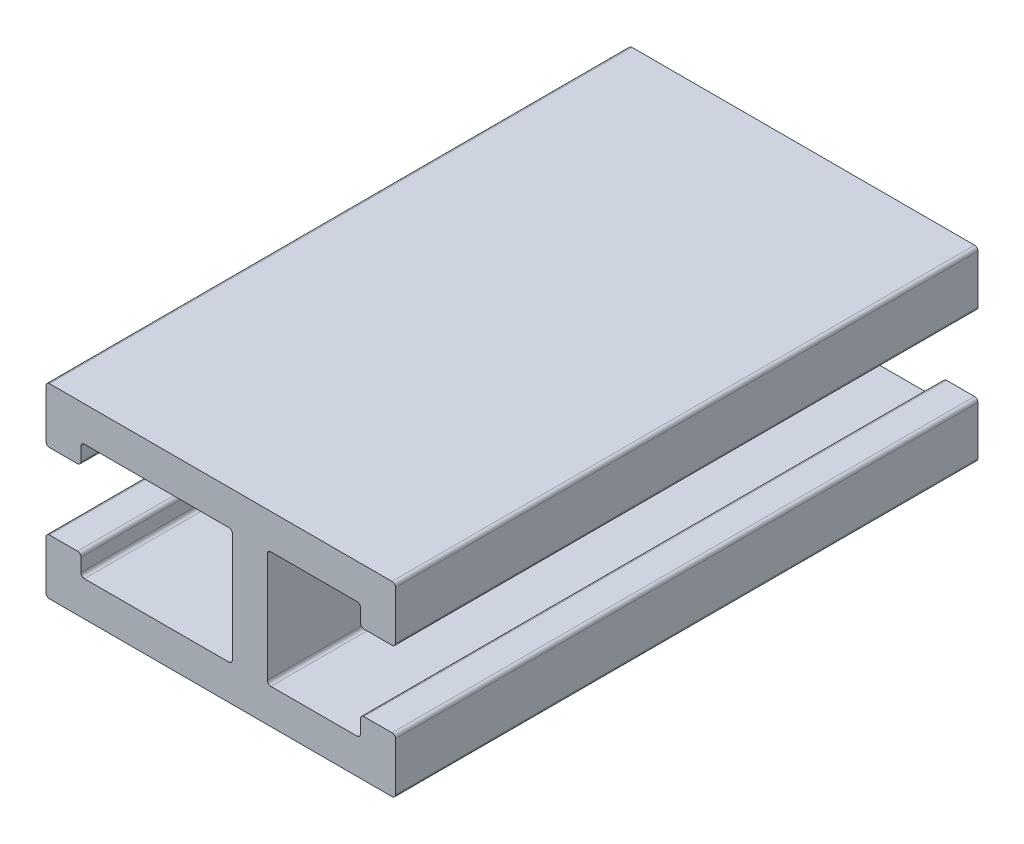
from build123d import *

# Parameters (mm, degrees)
EXTRUDE_1_DEPTH = 50


with BuildPart() as part:
    # 草图1 → 凸台-拉伸1 (new body)
    with BuildSketch(Plane.XY):
        with BuildLine():
            Line((-11.577197952, 5.757012623), (0.822802048, 5.757012623))
            ThreePointArc((0.822802048, 5.757012623), (1.034934082, 5.669144657), (1.122802048, 5.457012623))
            Line((1.122802048, 5.457012623), (1.122802048, -3.942987377))
            ThreePointArc((1.122802048, -3.942987377), (1.034934082, -4.155119412), (0.822802048, -4.242987377))
            Line((0.822802048, -4.242987377), (-11.577197952, -4.242987377))
            ThreePointArc((-11.577197952, -4.242987377), (-11.789329987, -4.155119412), (-11.877197952, -3.942987377))
            Line((-11.877197952, -3.942987377), (-11.877197952, -2.792987377))
            ThreePointArc((-11.877197952, -2.792987377), (-11.965065918, -2.580855343), (-12.177197952, -2.492987377))
            Line((-12.177197952, -2.492987377), (-14.577197952, -2.492987377))
            ThreePointArc((-14.577197952, -2.492987377), (-14.789329987, -2.580855343), (-14.877197952, -2.792987377))
            Line((-14.877197952, -2.792987377), (-14.877197952, -6.942987377))
            ThreePointArc((-14.877197952, -6.942987377), (-14.789329987, -7.155119412), (-14.577197952, -7.242987377))
            Line((-14.577197952, -7.242987377), (14.822802048, -7.242987377))
            ThreePointArc((14.822802048, -7.242987377), (15.034934082, -7.155119412), (15.122802048, -6.942987377))
            Line((15.122802048, -6.942987377), (15.122802048, -2.792987377))
            ThreePointArc((15.122802048, -2.792987377), (15.034934082, -2.580855343), (14.822802048, -2.492987377))
            Line((14.822802048, -2.492987377), (12.422802048, -2.492987377))
            ThreePointArc((12.422802048, -2.492987377), (12.210670013, -2.580855343), (12.122802048, -2.792987377))
            Line((12.122802048, -2.792987377), (12.122802048, -3.942987377))
            ThreePointArc((12.122802048, -3.942987377), (12.034934082, -4.155119412), (11.822802048, -4.242987377))
            Line((11.822802048, -4.242987377), (4.422802048, -4.242987377))
            ThreePointArc((4.422802048, -4.242987377), (4.210670013, -4.155119412), (4.122802048, -3.942987377))
            Line((4.122802048, -3.942987377), (4.122802048, 5.457012623))
            ThreePointArc((4.122802048, 5.457012623), (4.210670013, 5.669144657), (4.422802048, 5.757012623))
            Line((4.422802048, 5.757012623), (11.822802048, 5.757012623))
            ThreePointArc((11.822802048, 5.757012623), (12.034934082, 5.669144657), (12.122802048, 5.457012623))
            Line((12.122802048, 5.457012623), (12.122802048, 4.307012623))
            ThreePointArc((12.122802048, 4.307012623), (12.210670013, 4.094880588), (12.422802048, 4.007012623))
            Line((12.422802048, 4.007012623), (14.822802048, 4.007012623))
            ThreePointArc((14.822802048, 4.007012623), (15.034934082, 4.094880588), (15.122802048, 4.307012623))
            Line((15.122802048, 4.307012623), (15.122802048, 8.457012623))
            ThreePointArc((15.122802048, 8.457012623), (15.034934082, 8.669144657), (14.822802048, 8.757012623))
            Line((14.822802048, 8.757012623), (-14.577197952, 8.757012623))
            ThreePointArc((-14.577197952, 8.757012623), (-14.789329987, 8.669144657), (-14.877197952, 8.457012623))
            Line((-14.877197952, 8.457012623), (-14.877197952, 4.307012623))
            ThreePointArc((-14.877197952, 4.307012623), (-14.789329987, 4.094880588), (-14.577197952, 4.007012623))
            Line((-14.577197952, 4.007012623), (-12.177197952, 4.007012623))
            ThreePointArc((-12.177197952, 4.007012623), (-11.965065918, 4.094880588), (-11.877197952, 4.307012623))
            Line((-11.877197952, 4.307012623), (-11.877197952, 5.457012623))
            ThreePointArc((-11.877197952, 5.457012623), (-11.789329987, 5.669144657), (-11.577197952, 5.757012623))
        make_face()
    extrude(amount=EXTRUDE_1_DEPTH)


solid = part.part
